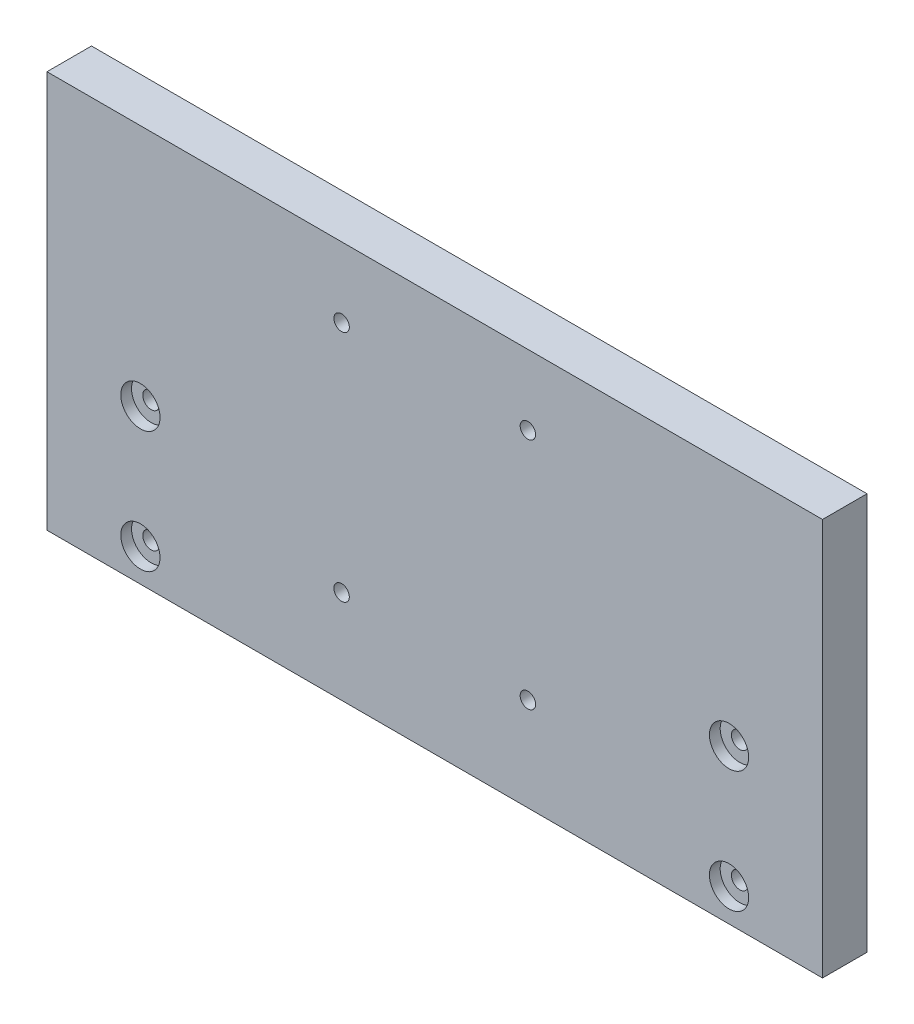
from build123d import *

# Parameters (mm, degrees)
SKETCH1_W                                        = 166
SKETCH1_H                                        = 85
BOSS_EXTRUDE3_DEPTH                              = 9.53
CBORE_FOR_M3_HEX_HEAD_MACHINE_SCREW2_D           = 3.6
CBORE_FOR_M3_HEX_HEAD_MACHINE_SCREW2_CBORE_D     = 8.4
CBORE_FOR_M3_HEX_HEAD_MACHINE_SCREW2_CBORE_DEPTH = 2.3
M4X0_7_TAPPED_HOLE1_D                            = 3.3
M4X0_7_TAPPED_HOLE1_DEPTH                        = 10.1
M4X0_7_TAPPED_HOLE1_TIP                          = 0.991420021


with BuildPart() as part:
    # Sketch1 → Boss-Extrude3 (new body)
    with BuildSketch(Plane(origin=(0, 0, 0), x_dir=(-1, 0, 0), z_dir=(0, 0, 1))):
        with Locations((-83, -42.5)):
            Rectangle(SKETCH1_W, SKETCH1_H)
    extrude(amount=BOSS_EXTRUDE3_DEPTH)

    # CBORE for M3 Hex Head Machine Screw2 (through all)
    with Locations(Plane(origin=(20, 33, 9.53), x_dir=(1, 0, 0), z_dir=(0, 0, 1))):
        with Locations((0, 0), (0, -26), (126, 0), (126, -26)):
            CounterBoreHole(CBORE_FOR_M3_HEX_HEAD_MACHINE_SCREW2_D / 2, CBORE_FOR_M3_HEX_HEAD_MACHINE_SCREW2_CBORE_D / 2, CBORE_FOR_M3_HEX_HEAD_MACHINE_SCREW2_CBORE_DEPTH)

    # M4x0.7 Tapped Hole1
    with Locations(Plane(origin=(63.065, 70, 9.53), x_dir=(1, 0, 0), z_dir=(0, 0, 1))):
        with Locations((0, 0), (0, -50), (39.87, 0), (39.87, -50)):
            Hole(M4X0_7_TAPPED_HOLE1_D / 2, depth=M4X0_7_TAPPED_HOLE1_DEPTH)
            with Locations((0, 0, -(M4X0_7_TAPPED_HOLE1_DEPTH + M4X0_7_TAPPED_HOLE1_TIP / 2))):  # 118° drill point
                Cone(0, M4X0_7_TAPPED_HOLE1_D / 2, M4X0_7_TAPPED_HOLE1_TIP, mode=Mode.SUBTRACT)


solid = part.part
